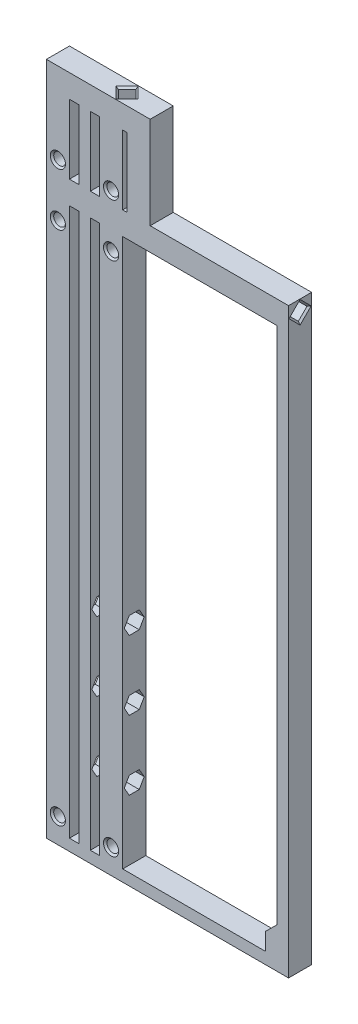
from build123d import *

# Parameters (mm, degrees)
SKETCH1_W                              = 1.616667666
SKETCH1_H                              = 25.4
SKETCH1_W_2                            = 3.4249995
SKETCH1_H_2                            = 201.083333334
BOSS_EXTRUDE1_DEPTH                    = 8.466666667
REAR_PINS_DEPTH                        = 6.35
BOTTOM_PINS_DEPTH                      = 6.35
FRONT_PINS_DEPTH                       = 6.35
RIGHT_PINS_DEPTH                       = 6.35
CUT_EXTRUDE1_DEPTH                     = 6.35
CHAMFER3_SIZE                          = 0.635
F_18_0_1695_DIAMETER_HOLE1_D           = 4.3053
F_18_0_1695_DIAMETER_HOLE1_CSINK_D     = 5.5753
F_18_0_1695_DIAMETER_HOLE1_CSINK_ANGLE = 90
CUT_EXTRUDE2_REACH                     = 140.243


with BuildPart() as part:
    # Sketch1 → Boss-Extrude1 (new body)
    with BuildSketch(Plane.XY):
        Polygon((-6.35, 123.825), (-44.45, 123.825), (-44.45, -123.825), (44.45, -123.825), (44.45, 89.958333333), (-6.35, 89.958333333), align=None)
        Polygon((35.983333333, -119.591666667), (35.983333333, -113.241666667), (40.216666667, -109.008333333), (40.216666667, 81.491666667), (-16.433334333, 81.491666667), (-16.433334333, -119.591666667), align=None, mode=Mode.SUBTRACT)
        with Locations((-15.6250005, 102.658333333)):
            Rectangle(SKETCH1_W, SKETCH1_H, mode=Mode.SUBTRACT)
        with Locations((-34.270833583, 102.658333333)):
            Rectangle(SKETCH1_W_2, SKETCH1_H, mode=Mode.SUBTRACT)
        with Locations((-34.270833583, -19.05)):
            Rectangle(SKETCH1_W_2, SKETCH1_H_2, mode=Mode.SUBTRACT)
        with Locations((-26.61250075, 102.658333333)):
            Rectangle(SKETCH1_W_2, SKETCH1_H, mode=Mode.SUBTRACT)
        with Locations((-26.61250075, -19.05)):
            Rectangle(SKETCH1_W_2, SKETCH1_H_2, mode=Mode.SUBTRACT)
    extrude(amount=BOSS_EXTRUDE1_DEPTH)

    # Sketch4 → rear pins (cut)
    with BuildSketch(Plane.ZY.offset(44.45)):
        Polygon((1.058333333, 85.725), (4.233333333, 88.9), (7.408333333, 85.725), (4.233333333, 82.55), align=None)
        Polygon((1.058333333, 119.591666667), (4.233333333, 122.766666667), (7.408333333, 119.591666667), (4.233333333, 116.416666667), align=None)
    extrude(amount=-REAR_PINS_DEPTH, mode=Mode.SUBTRACT)

    # Sketch5 → bottom pins (cut)
    with BuildSketch(Plane.XZ.offset(123.825)):
        Polygon((-23.841667667, 4.233333333), (-20.666667667, 7.408333333), (-17.491667667, 4.233333333), (-20.666667667, 1.058333333), align=None)
        Polygon((37.041666667, 4.233333333), (40.216666667, 7.408333333), (43.391666667, 4.233333333), (40.216666667, 1.058333333), align=None)
        Polygon((-43.391666667, 4.233333333), (-40.216666667, 7.408333333), (-37.041666667, 4.233333333), (-40.216666667, 1.058333333), align=None)
    extrude(amount=-BOTTOM_PINS_DEPTH, mode=Mode.SUBTRACT)

    # Sketch2 → front pins (cut)
    with BuildSketch(Plane(origin=(44.45, 0, 0), x_dir=(0, 0, -1), z_dir=(1, 0, 0))):
        Polygon((-7.408333333, 85.725), (-4.233333333, 88.9), (-1.058333333, 85.725), (-4.233333333, 82.55), align=None)
    extrude(amount=-FRONT_PINS_DEPTH, mode=Mode.SUBTRACT)

    # Sketch7 → right pins (cut)
    with BuildSketch(Plane(origin=(0, 0, 0), x_dir=(-1, 0, 0), z_dir=(0, 0, -1))):
        Polygon((7.408333333, 85.725), (10.583333333, 88.9), (13.758333333, 85.725), (10.583333333, 82.55), align=None)
        Polygon((10.583333333, 122.766666667), (13.758333333, 119.591666667), (10.583333333, 116.416666667), (7.408333333, 119.591666667), align=None)
    extrude(amount=-RIGHT_PINS_DEPTH, mode=Mode.SUBTRACT)

    # Sketch14 → Cut-Extrude1 (cut)
    with BuildSketch(Plane(origin=(0, 123.825, 0), x_dir=(1, 0, 0), z_dir=(0, 1, 0))):
        Polygon((-22.225, -4.233333333), (-19.05, -1.058333333), (-15.875, -4.233333333), (-19.05, -7.408333333), align=None)
    extrude(amount=-CUT_EXTRUDE1_DEPTH, mode=Mode.SUBTRACT)

    # Chamfer3
    chamfer3_edges = [part.edges().sort_by_distance(p)[0] for p in [
        (-38.1, 84.1375, 2.645833333),
        (-38.1, 87.3125, 2.645833333),
        (-38.1, 87.3125, 5.820833333),
        (-38.1, 84.1375, 5.820833333),
        (-44.45, 84.1375, 2.645833333),
        (-44.45, 84.1375, 5.820833333),
        (-44.45, 87.3125, 5.820833333),
        (-44.45, 87.3125, 2.645833333),
        (-38.1, 118.004166667, 2.645833333),
        (-38.1, 121.179166667, 2.645833333),
        (-38.1, 121.179166667, 5.820833333),
        (-38.1, 118.004166667, 5.820833333),
        (-44.45, 118.004166667, 2.645833333),
        (-44.45, 118.004166667, 5.820833333),
        (-44.45, 121.179166667, 5.820833333),
        (-44.45, 121.179166667, 2.645833333),
        (-41.804166667, -117.475, 2.645833333),
        (-41.804166667, -117.475, 5.820833333),
        (-38.629166667, -117.475, 5.820833333),
        (-38.629166667, -117.475, 2.645833333),
        (-41.804166667, -123.825, 2.645833333),
        (-38.629166667, -123.825, 2.645833333),
        (-38.629166667, -123.825, 5.820833333),
        (-41.804166667, -123.825, 5.820833333),
        (38.629166667, -117.475, 2.645833333),
        (38.629166667, -117.475, 5.820833333),
        (41.804166667, -117.475, 5.820833333),
        (41.804166667, -117.475, 2.645833333),
        (38.629166667, -123.825, 2.645833333),
        (41.804166667, -123.825, 2.645833333),
        (41.804166667, -123.825, 5.820833333),
        (38.629166667, -123.825, 5.820833333),
        (-22.254167667, -117.475, 2.645833333),
        (-22.254167667, -117.475, 5.820833333),
        (-19.079167667, -117.475, 5.820833333),
        (-19.079167667, -117.475, 2.645833333),
        (-22.254167667, -123.825, 2.645833333),
        (-19.079167667, -123.825, 2.645833333),
        (-19.079167667, -123.825, 5.820833333),
        (-22.254167667, -123.825, 5.820833333),
        (38.1, 84.1375, 5.820833333),
        (38.1, 87.3125, 5.820833333),
        (38.1, 87.3125, 2.645833333),
        (38.1, 84.1375, 2.645833333),
        (44.45, 84.1375, 5.820833333),
        (44.45, 84.1375, 2.645833333),
        (44.45, 87.3125, 2.645833333),
        (44.45, 87.3125, 5.820833333),
        (-8.995833333, 84.1375, 6.35),
        (-8.995833333, 87.3125, 6.35),
        (-12.170833333, 87.3125, 6.35),
        (-12.170833333, 84.1375, 6.35),
        (-8.995833333, 84.1375, 0),
        (-12.170833333, 84.1375, 0),
        (-12.170833333, 87.3125, 0),
        (-8.995833333, 87.3125, 0),
        (-8.995833333, 121.179166667, 6.35),
        (-12.170833333, 121.179166667, 6.35),
        (-12.170833333, 118.004166667, 6.35),
        (-8.995833333, 118.004166667, 6.35),
        (-8.995833333, 121.179166667, 0),
        (-8.995833333, 118.004166667, 0),
        (-12.170833333, 118.004166667, 0),
        (-12.170833333, 121.179166667, 0),
        (-20.6375, 117.475, 5.820833333),
        (-20.6375, 117.475, 2.645833333),
        (-17.4625, 117.475, 2.645833333),
        (-17.4625, 117.475, 5.820833333),
        (-20.6375, 123.825, 5.820833333),
        (-17.4625, 123.825, 5.820833333),
        (-17.4625, 123.825, 2.645833333),
        (-20.6375, 123.825, 2.645833333),
    ]]
    chamfer(chamfer3_edges, length=CHAMFER3_SIZE)

    # #18 (0.1695) Diameter Hole1 (through all)
    with Locations(Plane.XY.offset(8.466666667)):
        with Locations((-40.243, 74.630004822), (-40.251016872, -114.799997178), (-40.243, 93.980002822), (-20.701024762, 93.980002822), (-20.701024762, 74.630004822), (-20.701016872, -114.799997178)):
            CounterSinkHole(F_18_0_1695_DIAMETER_HOLE1_D / 2, F_18_0_1695_DIAMETER_HOLE1_CSINK_D / 2, counter_sink_angle=F_18_0_1695_DIAMETER_HOLE1_CSINK_ANGLE)

    # Cut-Extrude2: up to this face of the body (flat: up to its plane)
    cut_extrude2_end = Plane(part.part.faces().sort_by_distance((-32.558333833, -19.05, 4.233333333))[0])
    # Sketch15 → Cut-Extrude2 (cut, up to the picked face)
    with BuildSketch(Plane(origin=(-16.433334333, 0, 0), x_dir=(0, 0, -1), z_dir=(1, 0, 0)), mode=Mode.PRIVATE) as cut_extrude2_sk1:
        Polygon((-2.400246229, -97.366666667), (-0.567159124, -94.191666667), (-2.400246229, -91.016666667), (-6.066420438, -91.016666667), (-7.899507543, -94.191666667), (-6.066420438, -97.366666667), align=None)
    cut_extrude2_tool1 = split(extrude(cut_extrude2_sk1.sketch, amount=-CUT_EXTRUDE2_REACH, mode=Mode.PRIVATE), bisect_by=cut_extrude2_end, keep=Keep.BOTH, mode=Mode.PRIVATE)
    # Sketch15 → Cut-Extrude2 (cut, up to the picked face)
    with BuildSketch(Plane(origin=(-16.433334333, 0, 0), x_dir=(0, 0, -1), z_dir=(1, 0, 0)), mode=Mode.PRIVATE) as cut_extrude2_sk2:
        Polygon((-2.400246229, -71.966666667), (-0.567159124, -68.791666667), (-2.400246229, -65.616666667), (-6.066420438, -65.616666667), (-7.899507543, -68.791666667), (-6.066420438, -71.966666667), align=None)
    cut_extrude2_tool2 = split(extrude(cut_extrude2_sk2.sketch, amount=-CUT_EXTRUDE2_REACH, mode=Mode.PRIVATE), bisect_by=cut_extrude2_end, keep=Keep.BOTH, mode=Mode.PRIVATE)
    # Sketch15 → Cut-Extrude2 (cut, up to the picked face)
    with BuildSketch(Plane(origin=(-16.433334333, 0, 0), x_dir=(0, 0, -1), z_dir=(1, 0, 0)), mode=Mode.PRIVATE) as cut_extrude2_sk3:
        Polygon((-2.400246229, -46.566666667), (-0.567159124, -43.391666667), (-2.400246229, -40.216666667), (-6.066420438, -40.216666667), (-7.899507543, -43.391666667), (-6.066420438, -46.566666667), align=None)
    cut_extrude2_tool3 = split(extrude(cut_extrude2_sk3.sketch, amount=-CUT_EXTRUDE2_REACH, mode=Mode.PRIVATE), bisect_by=cut_extrude2_end, keep=Keep.BOTH, mode=Mode.PRIVATE)
    add(cut_extrude2_tool1.solids().sort_by(Axis((-16.433334, -94.191667, 4.233333), (-1, 0, 0)))[0], mode=Mode.SUBTRACT)
    add(cut_extrude2_tool2.solids().sort_by(Axis((-16.433334, -68.791667, 4.233333), (-1, 0, 0)))[0], mode=Mode.SUBTRACT)
    add(cut_extrude2_tool3.solids().sort_by(Axis((-16.433334, -43.391667, 4.233333), (-1, 0, 0)))[0], mode=Mode.SUBTRACT)


solid = part.part
